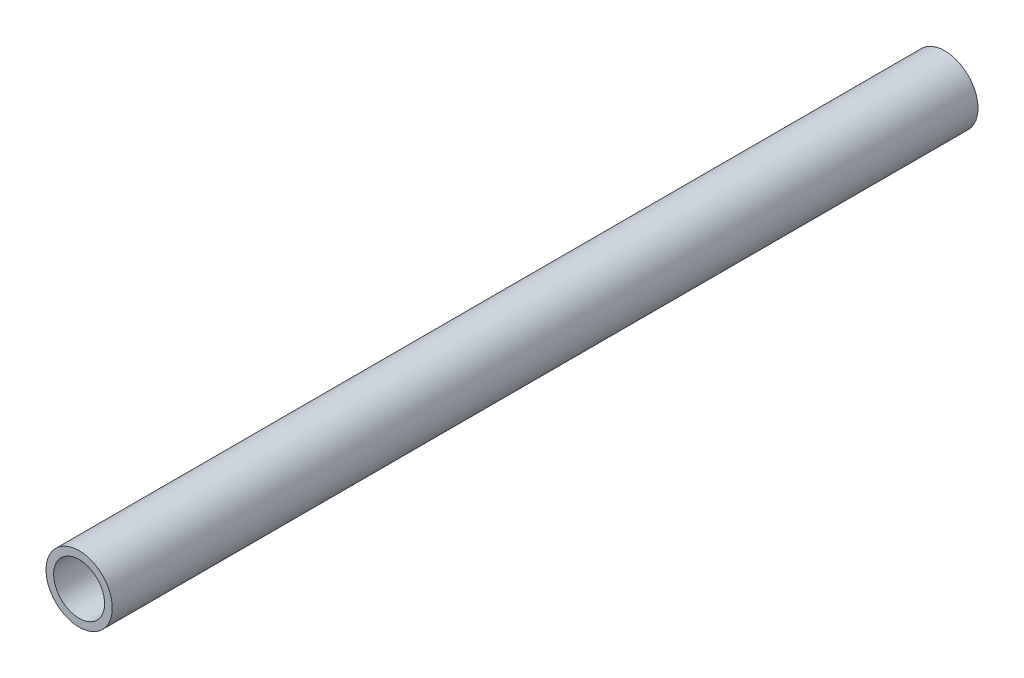
from build123d import *

# Parameters (mm, degrees)
SKETCH1_R           = 16.51
SKETCH1_R_2         = 12.7
BOSS_EXTRUDE1_DEPTH = 431.292


with BuildPart() as part:
    # Sketch1 → Boss-Extrude1 (new body)
    with BuildSketch(Plane.XY):
        with Locations(Location((0, 0, 0), (0, 0, 90))):
            Circle(SKETCH1_R)
        with Locations(Location((0, 0, 0), (0, 0, 90))):
            Circle(SKETCH1_R_2, mode=Mode.SUBTRACT)
    extrude(amount=BOSS_EXTRUDE1_DEPTH)


solid = part.part
